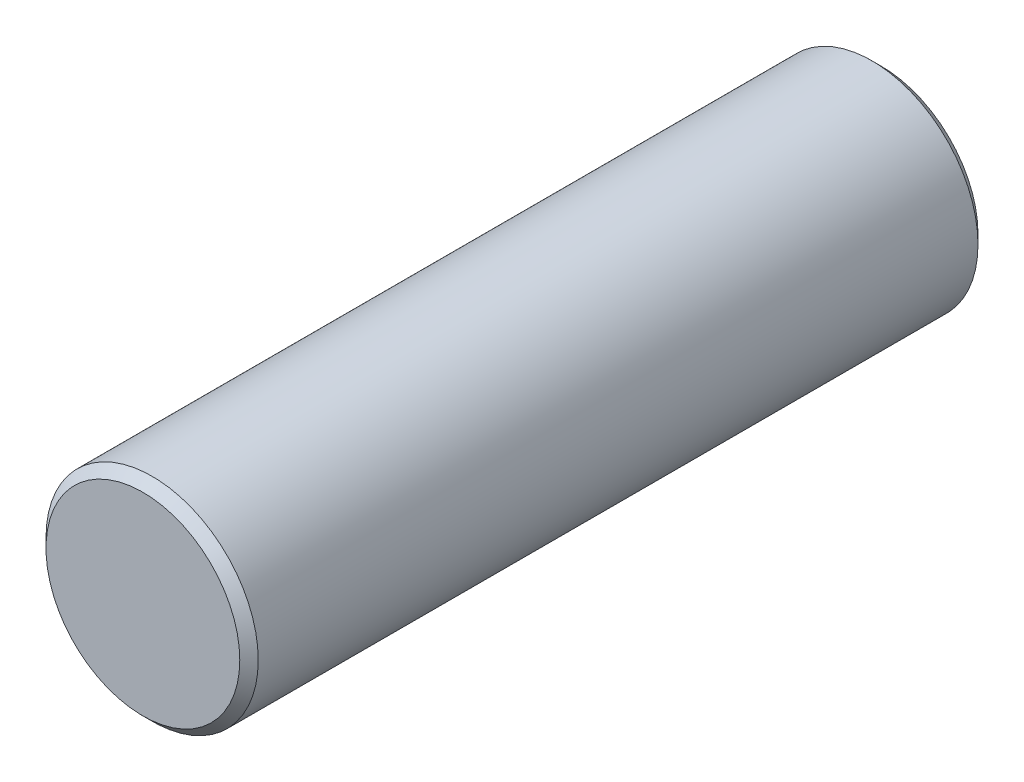
from build123d import *

# Parameters (mm, degrees)
SKETCH2_R                 = 11.5
BOSS_EXTRUDE1_DEPTH       = 80
CHAMFER1_SIZE             = 1
M6X1_0_TAPPED_HOLE1_D     = 5
M6X1_0_TAPPED_HOLE1_DEPTH = 11.5
M6X1_0_TAPPED_HOLE1_TIP   = 1.502151548


with BuildPart() as part:
    # Sketch2 → Boss-Extrude1 (new body)
    with BuildSketch(Plane.XY):
        Circle(SKETCH2_R)
    extrude(amount=BOSS_EXTRUDE1_DEPTH)

    # Chamfer1
    chamfer1_edges = [part.edges().sort_by_distance(p)[0] for p in [
        (-11.5, 0, 0),
        (-11.5, 0, 80),
    ]]
    chamfer(chamfer1_edges, length=CHAMFER1_SIZE)

    # M6x1.0 Tapped Hole1
    with Locations(Plane.XZ.offset(11.5)):
        with Locations((0, 15)):
            Hole(M6X1_0_TAPPED_HOLE1_D / 2, depth=M6X1_0_TAPPED_HOLE1_DEPTH)
            with Locations((0, 0, -(M6X1_0_TAPPED_HOLE1_DEPTH + M6X1_0_TAPPED_HOLE1_TIP / 2))):  # 118° drill point
                Cone(0, M6X1_0_TAPPED_HOLE1_D / 2, M6X1_0_TAPPED_HOLE1_TIP, mode=Mode.SUBTRACT)


solid = part.part
